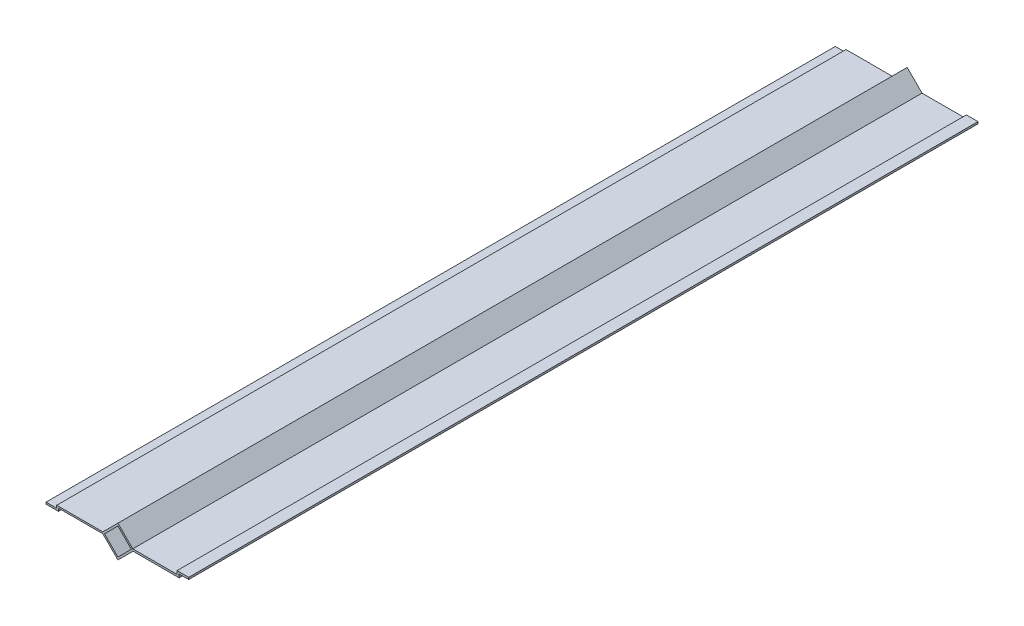
from build123d import *

# Parameters (mm, degrees)
BOSS_EXTRUDE1_DEPTH = 882


with BuildPart() as part:
    # Sketch1 → Boss-Extrude1 (new body)
    with BuildSketch(Plane.XY):
        Polygon((-66.385092096, 0.943335029), (-16.885092096, 0.943335029), (0, 17.828427125), (16.590763052, 1.237664072), (66.090763052, 1.237664072), (66.090763052, 2.937664072), (66.090763052, 4.937664072), (79.090763052, 4.937664072), (79.090763052, 2.756664971), (68.385092096, 2.756664971), (68.385092096, -0.943335029), (16.885092096, -0.943335029), (0, -17.828427125), (-16.885092096, -0.943335029), (-66.385092096, -0.943335029), (-66.385092096, -2.043335029), (-66.385092096, -4.043335029), (-68.385092096, -4.043335029), (-80.385092096, -4.043335029), (-80.385092096, -2.043335029), (-68.385092096, -2.043335029), (-68.385092096, 0.943335029), align=None)
        Polygon((-15, 0), (0, 15), (15, 0), (0, -15), align=None, mode=Mode.SUBTRACT)
    extrude(amount=BOSS_EXTRUDE1_DEPTH)


solid = part.part
